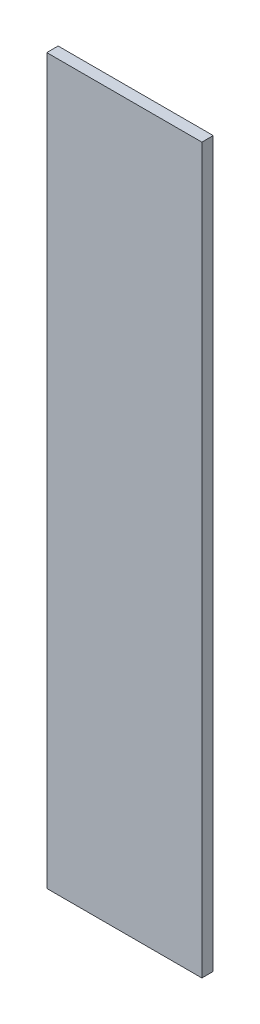
from build123d import *

# Parameters (mm, degrees)
CROQUIS1_W              = 75
CROQUIS1_H              = 350
SALIENTE_EXTRUIR1_DEPTH = 5.5


with BuildPart() as part:
    # Croquis1 → Saliente-Extruir1 (new body)
    with BuildSketch(Plane.XY):
        with Locations((-28.829498208, -97.372611465)):
            Rectangle(CROQUIS1_W, CROQUIS1_H)
    extrude(amount=SALIENTE_EXTRUIR1_DEPTH)


solid = part.part
